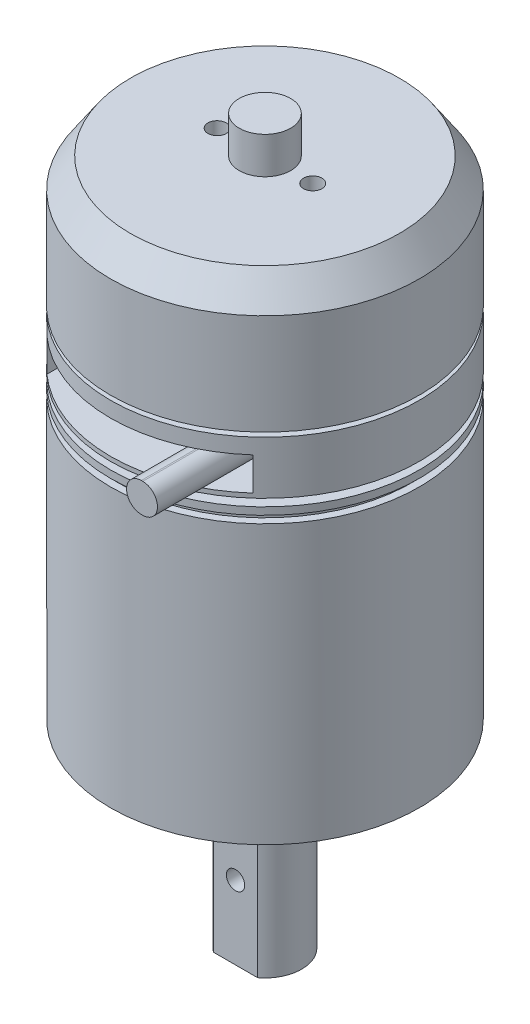
from build123d import *

# Parameters (mm, degrees)
SKETCH_2_W             = 28
SKETCH_2_H             = 4.5
CUT_EXTRUDE_1_DEPTH    = 10
EXTRUDE_1_DEPTH        = 15
HOLE_WIZARD_M3_1_D     = 2.5
HOLE_WIZARD_M3_1_DEPTH = 4
HOLE_WIZARD_M3_1_TIP   = 0.751075774
CUT_EXTRUDE_START      = -20
CUT_EXTRUDE_2_DEPTH    = 20
HOLE_WIZARD_M4_1_D     = 3.3
HOLE_WIZARD_M4_1_DEPTH = 10.1
HOLE_WIZARD_M4_1_TIP   = 0.991420021
HOLE_WIZARD_M3_2_D     = 2.5


with BuildPart() as part:
    # 草图1 → 旋转1 (revolve)
    with BuildSketch(Plane.XY, mode=Mode.PRIVATE) as revolve_1_sk:
        Polygon((0, 0), (4.1, 0), (4.1, 6.7), (13.4, 6.7), (13.4, 8.7), (21, 8.7), (21, 10.2), (20, 10.2), (20, 11.2), (21, 11.2), (21, 12.2), (10, 12.2), (10, 13.2), (21, 13.2), (21, 20.4), (5, 20.4), (5, 21), (21, 21), (21, 34.7), (18.3, 38.7), (3.5, 38.7), (3.5, 43.7), (0, 43.7), align=None)
    revolve(revolve_1_sk.sketch.rotate(Axis((0, 43.7, 0), (0, -1, 0)), 90), axis=Axis((0, 43.7, 0), (0, -1, 0)))

    # 草图2 → 切除-拉伸1 (cut)
    with BuildSketch(Plane.XY.offset(21)):
        with Locations((0, 16.05)):
            Rectangle(SKETCH_2_W, SKETCH_2_H)
    extrude(amount=-CUT_EXTRUDE_1_DEPTH, mode=Mode.SUBTRACT)

    # 草图3 → 凸台-拉伸1 (add)
    with BuildSketch(Plane.XY.offset(11)):
        with BuildLine():
            Line((9.185056323, 18.053194417), (9.385056323, 18.053194417))
            ThreePointArc((9.385056323, 18.053194417), (11.385056323, 16.053194417), (9.385056323, 14.053194417))
            Line((9.385056323, 14.053194417), (9.185056323, 14.053194417))
            ThreePointArc((9.185056323, 14.053194417), (7.185056323, 16.053194417), (9.185056323, 18.053194417))
        make_face()
    extrude(amount=EXTRUDE_1_DEPTH)

    # M3 螺纹孔1
    with Locations(Plane(origin=(0, 38.7, 0), x_dir=(1, 0, 0), z_dir=(0, 1, 0))):
        with Locations((-6.5, 0), (6.5, 0)):
            Hole(HOLE_WIZARD_M3_1_D / 2, depth=HOLE_WIZARD_M3_1_DEPTH)
            with Locations((0, 0, -(HOLE_WIZARD_M3_1_DEPTH + HOLE_WIZARD_M3_1_TIP / 2))):  # 118° drill point
                Cone(0, HOLE_WIZARD_M3_1_D / 2, HOLE_WIZARD_M3_1_TIP, mode=Mode.SUBTRACT)

    # 草图7 → 旋转2 (revolve)
    with BuildSketch(Plane.XY, mode=Mode.PRIVATE) as revolve_2_sk:
        Polygon((0, -54.6), (5, -54.6), (5, -30.5), (8.275, -30.5), (8.275, -29.6), (13, -29.6), (13, -27.6), (21, -27.6), (21, 8.7), (0, 8.7), align=None)
    revolve(revolve_2_sk.sketch.rotate(Axis((0, 8.7, 0), (0, -1, 0)), 180), axis=Axis((0, 8.7, 0), (0, -1, 0)))

    # 草图8 → 切除-拉伸2 (cut)
    with BuildSketch(Plane.XZ.offset(54.6).offset(CUT_EXTRUDE_START)):
        with BuildLine():
            Line((-3, 4), (3, 4))
            ThreePointArc((3, 4), (0, 5), (-3, 4))
        make_face()
    extrude(amount=CUT_EXTRUDE_2_DEPTH, mode=Mode.SUBTRACT)

    # M4 螺纹孔1
    with Locations(Plane(origin=(0, -27.6, 0), x_dir=(-1, 0, 0), z_dir=(0, -1, 0))):
        with Locations((0, -17.5), (-17.5, 0), (0, 17.5), (17.5, 0)):
            Hole(HOLE_WIZARD_M4_1_D / 2, depth=HOLE_WIZARD_M4_1_DEPTH)
            with Locations((0, 0, -(HOLE_WIZARD_M4_1_DEPTH + HOLE_WIZARD_M4_1_TIP / 2))):  # 118° drill point
                Cone(0, HOLE_WIZARD_M4_1_D / 2, HOLE_WIZARD_M4_1_TIP, mode=Mode.SUBTRACT)

    # M3 螺纹孔2 (through all)
    with Locations(Plane(origin=(0, -44.6, 4), x_dir=(1, 0, 0), z_dir=(0, 0, 1))):
        with Locations((0, 0)):
            Hole(HOLE_WIZARD_M3_2_D / 2)


solid = part.part
